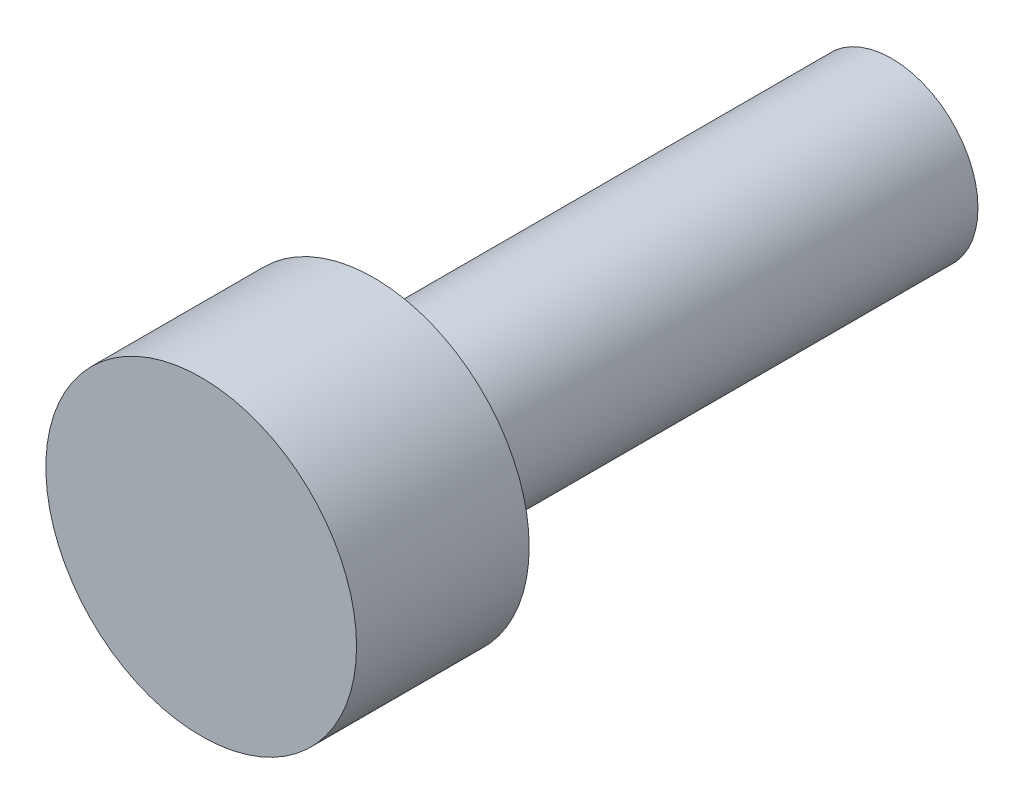
from build123d import *

# Parameters (mm, degrees)
SKETCH_1_R       = 1
M2X6_DEPTH       = 6
EXTRUDE_START    = 6
SKETCH_2_R       = 1.8
EXTRUDE_M2_DEPTH = 2


with BuildPart() as part:
    # 草图1 → M2x6简化螺杆 (new body)
    with BuildSketch(Plane.XY):
        Circle(SKETCH_1_R)
    extrude(amount=M2X6_DEPTH)

    # 草图2 → M2简化螺钉头 (add)
    with BuildSketch(Plane.XY.offset(EXTRUDE_START)):
        Circle(SKETCH_2_R)
    extrude(amount=EXTRUDE_M2_DEPTH)


solid = part.part
